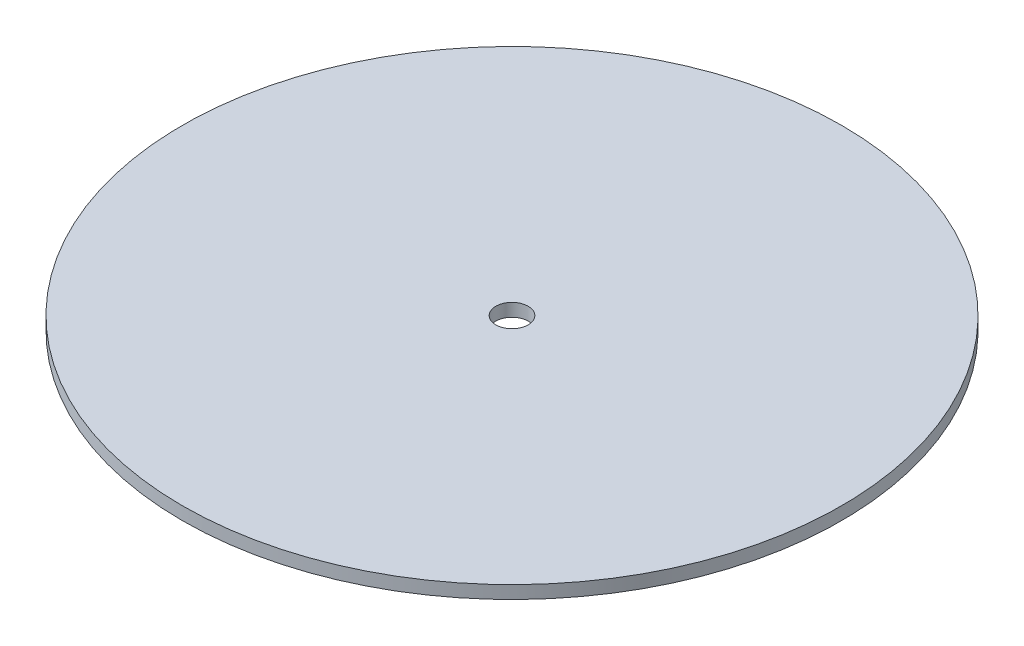
from build123d import *

# Parameters (mm, degrees)
SKETCH_4_R      = 102
SKETCH_4_R_2    = 5
EXTRUDE_1_DEPTH = 4


with BuildPart() as part:
    # Эскиз4 → Бобышка-Вытянуть1 (new body)
    with BuildSketch(Plane(origin=(0, 0, 0), x_dir=(1, 0, 0), z_dir=(0, 1, 0))):
        with Locations(Location((0, 0, 0), (0, 0, 270))):
            Circle(SKETCH_4_R)
        with Locations(Location((0, 0, 0), (0, 0, 270))):
            Circle(SKETCH_4_R_2, mode=Mode.SUBTRACT)
    extrude(amount=EXTRUDE_1_DEPTH)


solid = part.part
